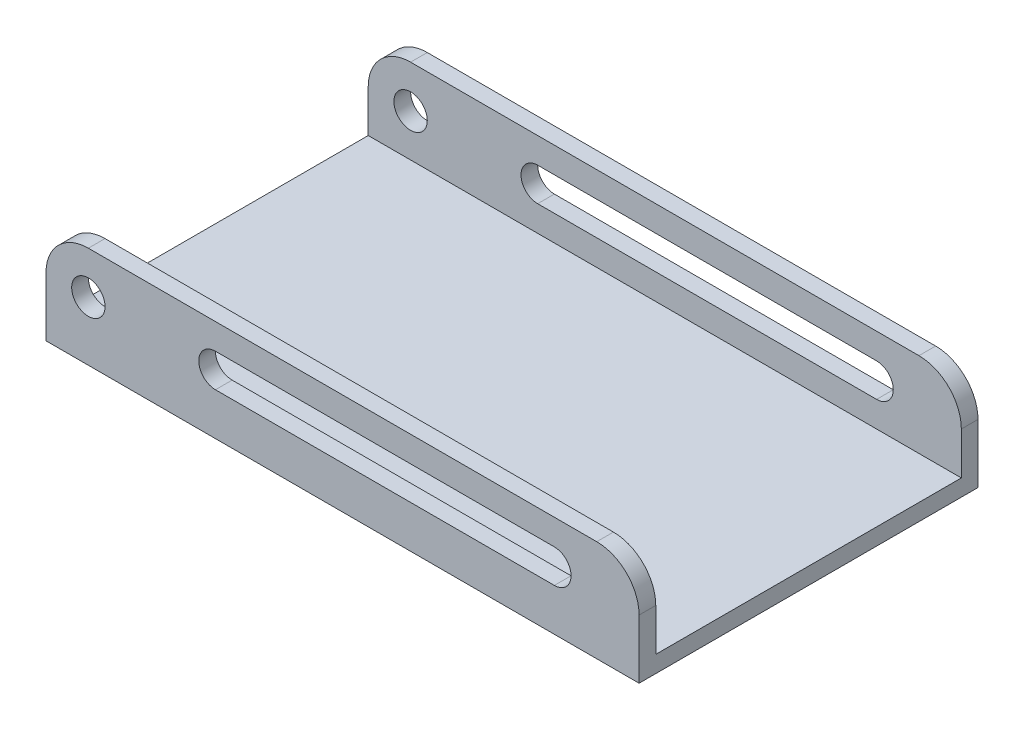
from build123d import *

# Parameters (mm, degrees)
SKETCH2_W           = 177.8
SKETCH2_H           = 101.6
BOSS_EXTRUDE1_DEPTH = 5
SKETCH3_W           = 177.8
SKETCH3_H           = 5
BOSS_EXTRUDE3_DEPTH = 25.4
SKETCH4_R           = 5
CUT_EXTRUDE1_DEPTH  = 208.025505675
FILLET1_R           = 12.7


with BuildPart() as part:
    # Sketch2 → Boss-Extrude1 (new body)
    with BuildSketch(Plane(origin=(0, 0, 0), x_dir=(1, 0, 0), z_dir=(0, 1, 0))):
        with Locations((88.9, 50.8)):
            Rectangle(SKETCH2_W, SKETCH2_H)
    extrude(amount=BOSS_EXTRUDE1_DEPTH)

    # Sketch3 → Boss-Extrude3 (add)
    with BuildSketch(Plane(origin=(0, 5, 0), x_dir=(1, 0, 0), z_dir=(0, 1, 0))):
        with Locations((88.9, 2.5)):
            Rectangle(SKETCH3_W, SKETCH3_H)
        with Locations((88.9, 99.1)):
            Rectangle(SKETCH3_W, SKETCH3_H)
    extrude(amount=BOSS_EXTRUDE3_DEPTH)

    # Sketch4 → Cut-Extrude1 (cut, through all)
    with BuildSketch(Plane.XY):
        with Locations((12.7, 17.7)):
            Circle(SKETCH4_R)
        with BuildLine():
            Line((50.8, 22.7), (152.4, 22.7))
            ThreePointArc((152.4, 22.7), (157.4, 17.7), (152.4, 12.7))
            Line((152.4, 12.7), (50.8, 12.7))
            ThreePointArc((50.8, 12.7), (45.8, 17.7), (50.8, 22.7))
        make_face()
    extrude(amount=-CUT_EXTRUDE1_DEPTH, mode=Mode.SUBTRACT)

    # Fillet1
    fillet1_edges = [part.edges().sort_by_distance(p)[0] for p in [
        (0, 30.4, -2.5),
        (177.8, 30.4, -2.5),
        (0, 30.4, -99.1),
        (177.8, 30.4, -99.1),
    ]]
    fillet(fillet1_edges, radius=FILLET1_R)


solid = part.part
